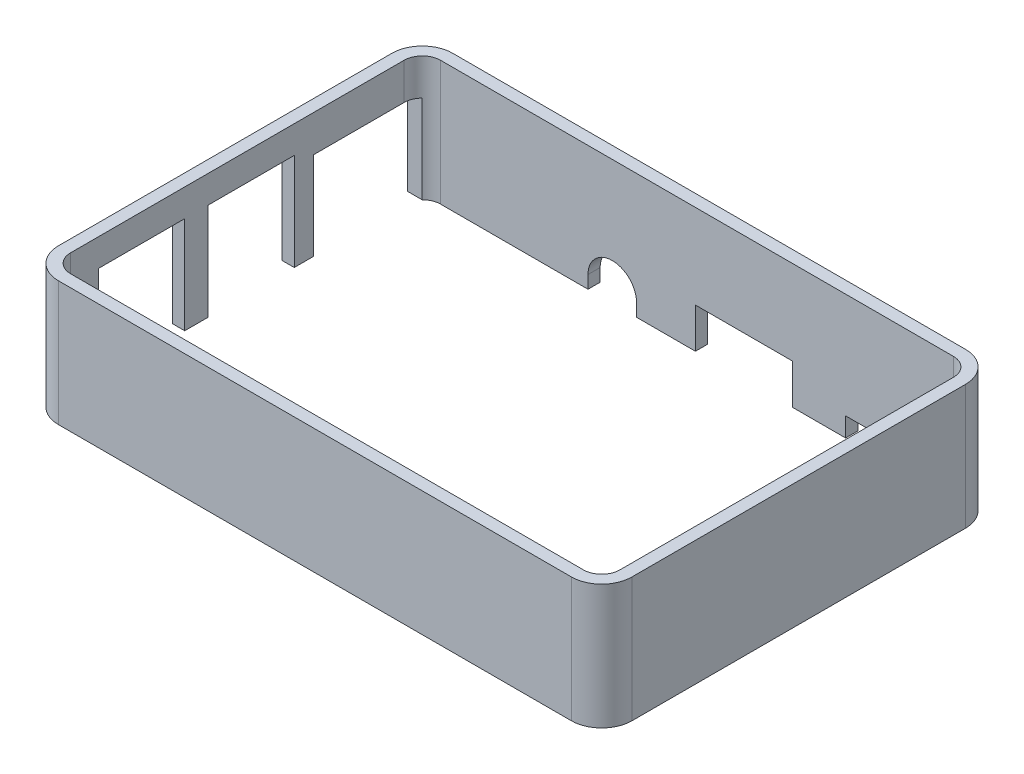
from build123d import *

# Parameters (mm, degrees)
BOSS_EXTRUDE1_DEPTH = 20.53
CUT_EXTRUDE1_REACH  = 112.841
SKETCH2_W           = 17
SKETCH2_H           = 14.5
SKETCH2_W_2         = 14.2
SKETCH2_H_2         = 16
CUT_EXTRUDE2_REACH  = 121.062
SKETCH3_W           = 9
SKETCH3_H           = 3.16
SKETCH3_W_2         = 16
SKETCH3_H_2         = 6.6


with BuildPart() as part:
    # Sketch1 → Boss-Extrude1 (new body)
    with BuildSketch(Plane(origin=(0, 0, 0), x_dir=(1, 0, 0), z_dir=(0, 1, 0))):
        with BuildLine():
            Line((-97.654422032, 2.625826009), (-97.654422032, -52.319988394))
            ThreePointArc((-97.654422032, -52.319988394), (-96.189955938, -55.8555223), (-92.654422032, -57.319988394))
            Line((-92.654422032, -57.319988394), (-8.154422032, -57.319988394))
            ThreePointArc((-8.154422032, -57.319988394), (-4.618888126, -55.8555223), (-3.154422032, -52.319988394))
            Line((-3.154422032, -52.319988394), (-3.154422032, 2.625826009))
            ThreePointArc((-3.154422032, 2.625826009), (-4.618888126, 6.161359915), (-8.154422032, 7.625826009))
            Line((-8.154422032, 7.625826009), (-92.654422032, 7.625826009))
            ThreePointArc((-92.654422032, 7.625826009), (-96.189955938, 6.161359915), (-97.654422032, 2.625826009))
        make_face()
        with BuildLine():
            Line((-92.654422032, 5.625826009), (-8.154422032, 5.625826009))
            ThreePointArc((-8.154422032, 5.625826009), (-6.033101689, 4.747146353), (-5.154422032, 2.625826009))
            Line((-5.154422032, 2.625826009), (-5.154422032, -52.319988394))
            ThreePointArc((-5.154422032, -52.319988394), (-6.033101689, -54.441308738), (-8.154422032, -55.319988394))
            Line((-8.154422032, -55.319988394), (-92.654422032, -55.319988394))
            ThreePointArc((-92.654422032, -55.319988394), (-94.775742376, -54.441308738), (-95.654422032, -52.319988394))
            Line((-95.654422032, -52.319988394), (-95.654422032, 2.625826009))
            ThreePointArc((-95.654422032, 2.625826009), (-94.775742376, 4.747146353), (-92.654422032, 5.625826009))
        make_face(mode=Mode.SUBTRACT)
    extrude(amount=BOSS_EXTRUDE1_DEPTH)

    # Sketch2 → Cut-Extrude1 (cut, up to next)
    with BuildSketch(Plane(origin=(-97.654422032, 0, 3.154422032), x_dir=(0, 0, 1), z_dir=(-1, 0, 0)), mode=Mode.PRIVATE) as cut_extrude1_sk1:
        with Locations((0.619751959, 7.25)):
            Rectangle(SKETCH2_W, SKETCH2_H)
    cut_extrude1_tool1 = extrude(cut_extrude1_sk1.sketch, amount=-CUT_EXTRUDE1_REACH, mode=Mode.PRIVATE) & part.part
    # Sketch2 → Cut-Extrude1 (cut, up to next)
    with BuildSketch(Plane(origin=(-97.654422032, 0, 3.154422032), x_dir=(0, 0, 1), z_dir=(-1, 0, 0)), mode=Mode.PRIVATE) as cut_extrude1_sk2:
        with Locations((19.419751959, 8)):
            Rectangle(SKETCH2_W_2, SKETCH2_H_2)
    cut_extrude1_tool2 = extrude(cut_extrude1_sk2.sketch, amount=-CUT_EXTRUDE1_REACH, mode=Mode.PRIVATE) & part.part
    # Sketch2 → Cut-Extrude1 (cut, up to next)
    with BuildSketch(Plane(origin=(-97.654422032, 0, 3.154422032), x_dir=(0, 0, 1), z_dir=(-1, 0, 0)), mode=Mode.PRIVATE) as cut_extrude1_sk3:
        with Locations((37.469751959, 8)):
            Rectangle(SKETCH2_W_2, SKETCH2_H_2)
    cut_extrude1_tool3 = extrude(cut_extrude1_sk3.sketch, amount=-CUT_EXTRUDE1_REACH, mode=Mode.PRIVATE) & part.part
    add(cut_extrude1_tool1.solids().sort_by_distance((-97.654422, 7.25, 3.774174))[0], mode=Mode.SUBTRACT)
    add(cut_extrude1_tool2.solids().sort_by_distance((-97.654422, 8, 22.574174))[0], mode=Mode.SUBTRACT)
    add(cut_extrude1_tool3.solids().sort_by_distance((-97.654422, 8, 40.624174))[0], mode=Mode.SUBTRACT)

    # Sketch3 → Cut-Extrude2 (cut, up to next)
    with BuildSketch(Plane.XY.offset(-7.625826009), mode=Mode.PRIVATE) as cut_extrude2_sk1:
        with Locations((-21.404422032, 1.58)):
            Rectangle(SKETCH3_W, SKETCH3_H)
    cut_extrude2_tool1 = extrude(cut_extrude2_sk1.sketch, amount=CUT_EXTRUDE2_REACH, mode=Mode.PRIVATE) & part.part
    # Sketch3 → Cut-Extrude2 (cut, up to next)
    with BuildSketch(Plane.XY.offset(-7.625826009), mode=Mode.PRIVATE) as cut_extrude2_sk2:
        with Locations((-42.654422032, 3.3)):
            Rectangle(SKETCH3_W_2, SKETCH3_H_2)
    cut_extrude2_tool2 = extrude(cut_extrude2_sk2.sketch, amount=CUT_EXTRUDE2_REACH, mode=Mode.PRIVATE) & part.part
    # Sketch3 → Cut-Extrude2 (cut, up to next)
    with BuildSketch(Plane.XY.offset(-7.625826009), mode=Mode.PRIVATE) as cut_extrude2_sk3:
        with BuildLine():
            Line((-68.354422032, 0), (-60.354422032, 0))
            Line((-60.354422032, 0), (-60.354422032, 2.1))
            ThreePointArc((-60.354422032, 2.1), (-64.354422032, 6.1), (-68.354422032, 2.1))
            Line((-68.354422032, 2.1), (-68.354422032, 0))
        make_face()
    cut_extrude2_tool3 = extrude(cut_extrude2_sk3.sketch, amount=CUT_EXTRUDE2_REACH, mode=Mode.PRIVATE) & part.part
    add(cut_extrude2_tool1.solids().sort_by_distance((-21.404422, 1.58, -7.625826))[0], mode=Mode.SUBTRACT)
    add(cut_extrude2_tool2.solids().sort_by_distance((-42.654422, 3.3, -7.625826))[0], mode=Mode.SUBTRACT)
    add(cut_extrude2_tool3.solids().sort_by_distance((-64.354422, 2.696829, -7.625826))[0], mode=Mode.SUBTRACT)


solid = part.part
